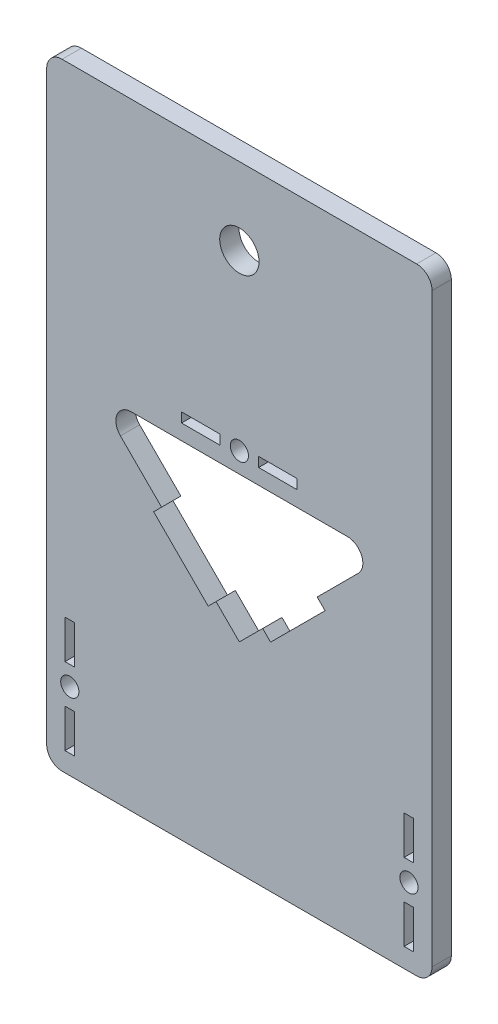
from build123d import *

# Parameters (mm, degrees)
SKETCH1_W           = 63.5
SKETCH1_H           = 38.1
SKETCH1_R           = 5.08
SKETCH1_R_2         = 3.2385
SKETCH1_H_2         = 63.5
SKETCH1_R_3         = 1.5
SKETCH1_W_2         = 6.35
SKETCH1_H_3         = 1.5875
BOSS_EXTRUDE1_DEPTH = 3.175
CUT_EXTRUDE1_DEPTH  = 3.175
SKETCH3_R           = 1.5
SKETCH3_W           = 1.5875
SKETCH3_H           = 6.35
CUT_EXTRUDE2_DEPTH  = 3.175
FILLET1_R           = 2.54


with BuildPart() as part:
    # Sketch1 → Boss-Extrude1 (new body)
    # profile 1 of 4: a face of its own
    with BuildSketch(Plane.XY):
        with Locations((31.75, 82.55)):
            Rectangle(SKETCH1_W, SKETCH1_H)
        with Locations((31.75, 88.9)):
            Circle(SKETCH1_R, mode=Mode.SUBTRACT)
    # profile 2 of 4: a face of its own
    with BuildSketch(Plane.XY):
        with Locations((31.75, 82.55)):
            Rectangle(SKETCH1_W, SKETCH1_H)
        with Locations((31.75, 88.9)):
            Circle(SKETCH1_R, mode=Mode.SUBTRACT)
    # profile 3 of 4: a face of its own
    with BuildSketch(Plane.XY):
        with Locations((31.75, 88.9)):
            Circle(SKETCH1_R)
        with Locations((31.75, 88.9)):
            Circle(SKETCH1_R_2, mode=Mode.SUBTRACT)
    # profile 4 of 4: a face of its own
    with BuildSketch(Plane.XY):
        with Locations((31.75, 31.75)):
            Rectangle(SKETCH1_W, SKETCH1_H_2)
        with Locations((31.75, 60.325)):
            Circle(SKETCH1_R_3, mode=Mode.SUBTRACT)
        with Locations((38.1, 60.325)):
            Rectangle(SKETCH1_W_2, SKETCH1_H_3, mode=Mode.SUBTRACT)
        Polygon((27.910940508, 36.891196629), (26.608803371, 35.589059492), (17.62854725, 44.569315613), (18.930684387, 45.87145275), align=None, mode=Mode.SUBTRACT)
        Polygon((45.87145275, 44.569315613), (44.569315613, 45.87145275), (35.589059492, 36.891196629), (36.891196629, 35.589059492), align=None, mode=Mode.SUBTRACT)
        with Locations((25.4, 60.325)):
            Rectangle(SKETCH1_W_2, SKETCH1_H_3, mode=Mode.SUBTRACT)
    extrude(amount=BOSS_EXTRUDE1_DEPTH)

    # Sketch2 → Cut-Extrude1 (cut)
    with BuildSketch(Plane.XY.offset(3.175)):
        Polygon((27.910940508, 36.891196629), (31.75, 33.052137138), (35.589059492, 36.891196629), (44.569315613, 45.87145275), (55.689112862, 56.99125), (7.810887138, 56.99125), (18.930684387, 45.87145275), align=None)
    extrude(amount=-CUT_EXTRUDE1_DEPTH, mode=Mode.SUBTRACT)

    # Sketch3 → Cut-Extrude2 (cut)
    with BuildSketch(Plane.XY.offset(3.175)):
        with Locations((3.81, 12.7)):
            Circle(SKETCH3_R)
        with Locations(Location((59.69, 12.7, 0), (0, 0, 180))):
            Circle(SKETCH3_R)
        with Locations((3.81, 19.05)):
            Rectangle(SKETCH3_W, SKETCH3_H)
        with Locations((3.81, 6.35)):
            Rectangle(SKETCH3_W, SKETCH3_H)
        with Locations((59.69, 6.35)):
            Rectangle(SKETCH3_W, SKETCH3_H)
        with Locations((59.69, 19.05)):
            Rectangle(SKETCH3_W, SKETCH3_H)
    extrude(amount=-CUT_EXTRUDE2_DEPTH, mode=Mode.SUBTRACT)

    # Fillet1
    fillet1_edges = [part.edges().sort_by_distance(p)[0] for p in [
        (0, 101.6, 1.5875),
        (63.5, 101.6, 1.5875),
        (63.5, 0, 1.5875),
        (0, 0, 1.5875),
        (55.689112862, 56.99125, 1.5875),
        (7.810887138, 56.99125, 1.5875),
    ]]
    fillet(fillet1_edges, radius=FILLET1_R)


solid = part.part
